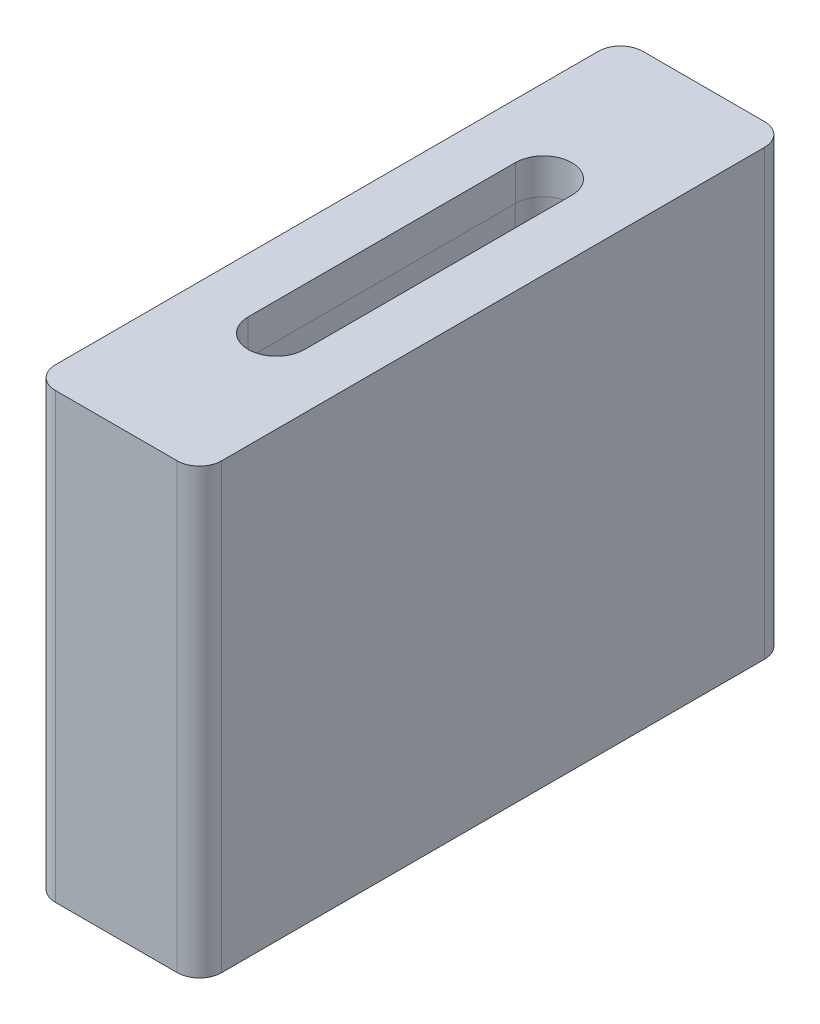
from build123d import *

# Parameters (mm, degrees)
BOSS_EXTRUDE1_DEPTH         = 40
CUT_EXTRUDE2_REACH          = 50.564
M6_TAPPED_HOLE1_D           = 5
M6_TAPPED_HOLE1_DEPTH       = 17
M6_TAPPED_HOLE1_CSINK_D     = 6.05
M6_TAPPED_HOLE1_CSINK_ANGLE = 90
M6_TAPPED_HOLE1_TIP         = 1.502151548


with BuildPart() as part:
    # Sketch1 → Boss-Extrude1 (new body)
    with BuildSketch(Plane(origin=(0, 0, 0), x_dir=(1, 0, 0), z_dir=(0, 1, 0))):
        with BuildLine():
            Line((-5.5, -26.5), (5.5, -26.5))
            ThreePointArc((5.5, -26.5), (6.914213562, -25.914213562), (7.5, -24.5))
            Line((7.5, -24.5), (7.5, 24.5))
            ThreePointArc((7.5, 24.5), (6.914213562, 25.914213562), (5.5, 26.5))
            Line((5.5, 26.5), (-5.5, 26.5))
            ThreePointArc((-5.5, 26.5), (-6.914213562, 25.914213562), (-7.5, 24.5))
            Line((-7.5, 24.5), (-7.5, -24.5))
            ThreePointArc((-7.5, -24.5), (-6.914213562, -25.914213562), (-5.5, -26.5))
        make_face()
    extrude(amount=-BOSS_EXTRUDE1_DEPTH)

    # Sketch5 → Cut-Extrude2 (cut, up to next)
    with BuildSketch(Plane(origin=(0, 0, 0), x_dir=(1, 0, 0), z_dir=(0, 1, 0)), mode=Mode.PRIVATE) as cut_extrude2_sk1:
        with BuildLine():
            Line((-2.55, -12.05), (-2.55, 12.05))
            ThreePointArc((-2.55, 12.05), (0, 14.6), (2.55, 12.05))
            Line((2.55, 12.05), (2.55, -12.05))
            ThreePointArc((2.55, -12.05), (0, -14.6), (-2.55, -12.05))
        make_face()
    cut_extrude2_tool1 = extrude(cut_extrude2_sk1.sketch, amount=-CUT_EXTRUDE2_REACH, mode=Mode.PRIVATE) & part.part
    add(cut_extrude2_tool1.solids().sort_by_distance((0, 0, 0))[0], mode=Mode.SUBTRACT)

    # Cut-Sweep1: sweep along a path in Sketch8
    with BuildLine(Plane(origin=(0, 0, 0), x_dir=(1, 0, 0), z_dir=(0, 1, 0))) as cut_sweep1_path:
        Line((-2.55, 12.05), (-2.55, -12.05))
        ThreePointArc((-2.55, -12.05), (0, -14.6), (2.55, -12.05))
        Line((2.55, -12.05), (2.55, 12.05))
        ThreePointArc((2.55, 12.05), (0, 14.6), (-2.55, 12.05))
    # Sketch7 → Cut-Sweep1 (sweep, cut)
    with BuildSketch(Plane.XY):
        Polygon((2.55, -3.2), (3.192346389, -40), (2.55, -40), align=None)
    sweep(path=cut_sweep1_path.line, mode=Mode.SUBTRACT)

    # M6 Tapped Hole1
    with Locations(Plane(origin=(0, -40, 0), x_dir=(-1, 0, 0), z_dir=(0, -1, 0))):
        with Locations((0, 22.5), (0, -22.5)):
            CounterSinkHole(M6_TAPPED_HOLE1_D / 2, M6_TAPPED_HOLE1_CSINK_D / 2, depth=M6_TAPPED_HOLE1_DEPTH, counter_sink_angle=M6_TAPPED_HOLE1_CSINK_ANGLE)
            with Locations((0, 0, -(M6_TAPPED_HOLE1_DEPTH + M6_TAPPED_HOLE1_TIP / 2))):  # 118° drill point
                Cone(0, M6_TAPPED_HOLE1_D / 2, M6_TAPPED_HOLE1_TIP, mode=Mode.SUBTRACT)


solid = part.part
